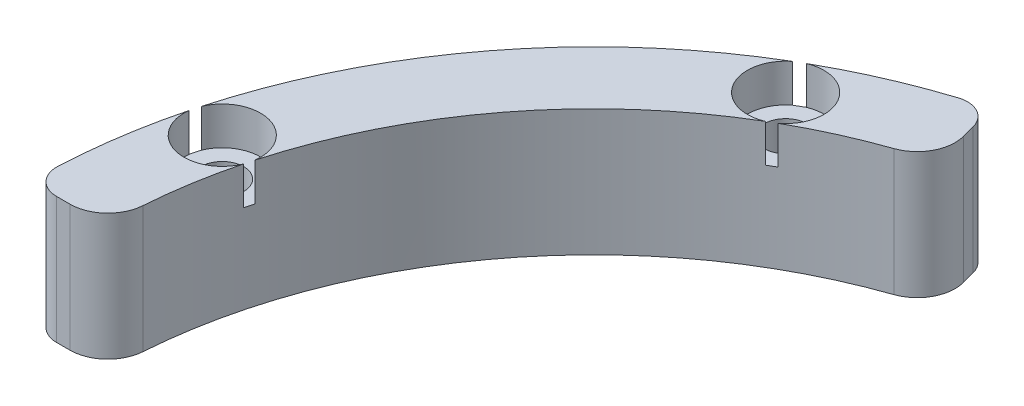
from build123d import *

# Parameters (mm, degrees)
SKETCH_1_W                  = 10
SKETCH_1_H                  = 6
REVOLVE_1_ANGLE             = 75
HOLE_WIZARD_M31_D           = 3.4
HOLE_WIZARD_M31_CBORE_D     = 6.05
HOLE_WIZARD_M31_CBORE_DEPTH = 3
FILLET_1_R                  = 2
FILLET_2_R                  = 3


with BuildPart() as part:
    # Эскиз1 → Повернуть1 (revolve)
    with BuildSketch(Plane(origin=(0, 0, 0), x_dir=(0, 1, 0), z_dir=(0.9659258262890689, 0, -0.258819045102519))):
        with Locations((5, -41.5)):
            Rectangle(SKETCH_1_W, SKETCH_1_H)
    revolve(axis=Axis((0, 10, 0), (0, 1, 0)), revolution_arc=REVOLVE_1_ANGLE)

    # Цековка для винта с заклепочной головкой M31 (through all)
    with Locations(Plane(origin=(0, 10, 0), x_dir=(1, 0, 0), z_dir=(0, 1, 0))):
        with Locations((-40.085921791, 10.740990372), (-20.75, 35.940054257)):
            CounterBoreHole(HOLE_WIZARD_M31_D / 2, HOLE_WIZARD_M31_CBORE_D / 2, HOLE_WIZARD_M31_CBORE_DEPTH)

    # Скругление1
    fillet_1_edges = [part.edges().sort_by_distance(p)[0] for p in [
        (-11.517447507, 5, -42.98369927),
        (-44.5, 5, 0),
    ]]
    fillet(fillet_1_edges, radius=FILLET_1_R)

    # Скругление2
    fillet_2_edges = [part.edges().sort_by_distance(p)[0] for p in [
        (-38.5, 5, 0),
        (-9.964533236, 5, -37.188144312),
    ]]
    fillet(fillet_2_edges, radius=FILLET_2_R)


solid = part.part
